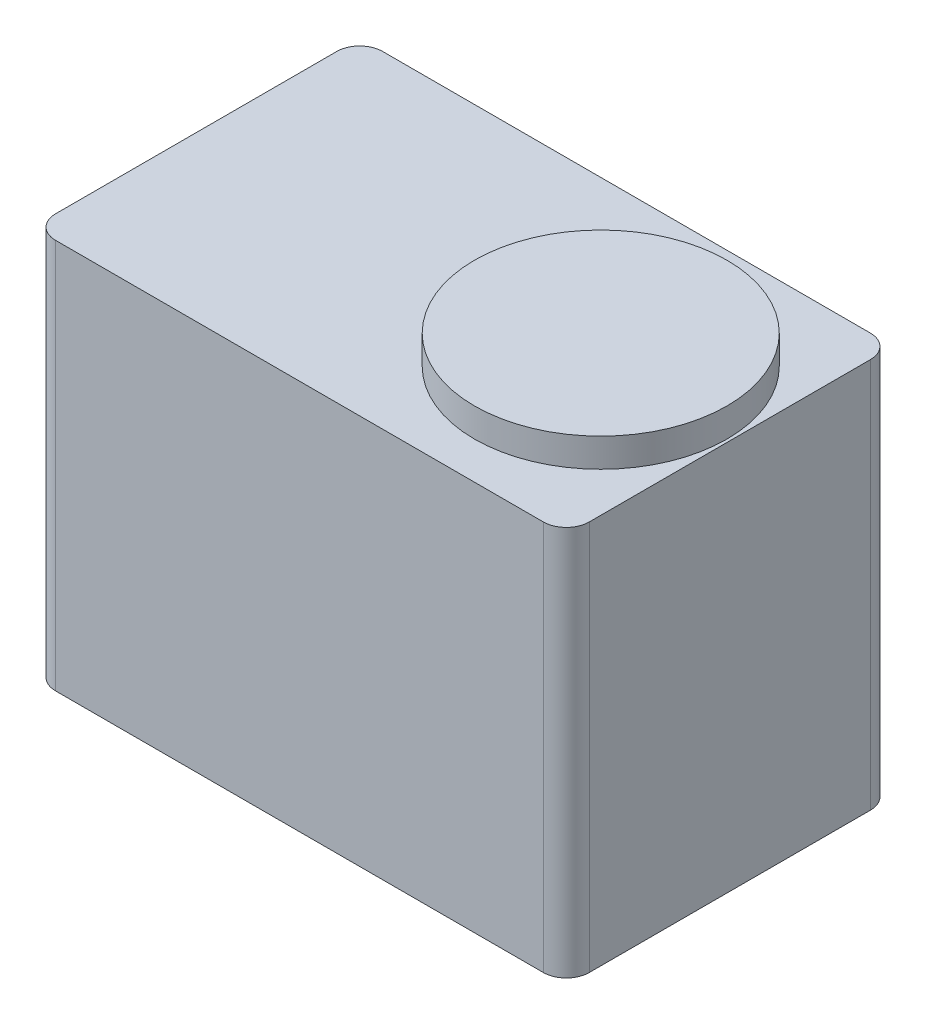
from build123d import *

# Parameters (mm, degrees)
HOUSING_START = -17
HOUSING_DEPTH = 34
HORN_START    = 17
SK_2_R        = 11
HORN_DEPTH    = 2.5
IDLER_START   = -18.5
SK_3_R        = 7
IDLER_DEPTH   = 1.5


with BuildPart() as part:
    # SK_1 → Housing (new body)
    with BuildSketch(Plane(origin=(0, 0, 0), x_dir=(1, 0, 0), z_dir=(0, 1, 0)).offset(HOUSING_START)):
        with BuildLine():
            Line((-21.25, -14.25), (21.25, -14.25))
            ThreePointArc((21.25, -14.25), (22.664213562, -13.664213562), (23.25, -12.25))
            Line((23.25, -12.25), (23.25, 12.25))
            ThreePointArc((23.25, 12.25), (22.664213562, 13.664213562), (21.25, 14.25))
            Line((21.25, 14.25), (-21.25, 14.25))
            ThreePointArc((-21.25, 14.25), (-22.664213562, 13.664213562), (-23.25, 12.25))
            Line((-23.25, 12.25), (-23.25, -12.25))
            ThreePointArc((-23.25, -12.25), (-22.664213562, -13.664213562), (-21.25, -14.25))
        make_face()
    extrude(amount=HOUSING_DEPTH)

    # SK_2 → Horn (add)
    with BuildSketch(Plane(origin=(0, 0, 0), x_dir=(1, 0, 0), z_dir=(0, 1, 0)).offset(HORN_START)):
        with Locations(Location((12, 0, 0), (0, 0, 270))):
            Circle(SK_2_R)
    extrude(amount=HORN_DEPTH)

    # SK_3 → Idler (add)
    with BuildSketch(Plane(origin=(0, 0, 0), x_dir=(1, 0, 0), z_dir=(0, 1, 0)).offset(IDLER_START)):
        with Locations(Location((12, 0, 0), (0, 0, 270))):
            Circle(SK_3_R)
    extrude(amount=IDLER_DEPTH)


solid = part.part
